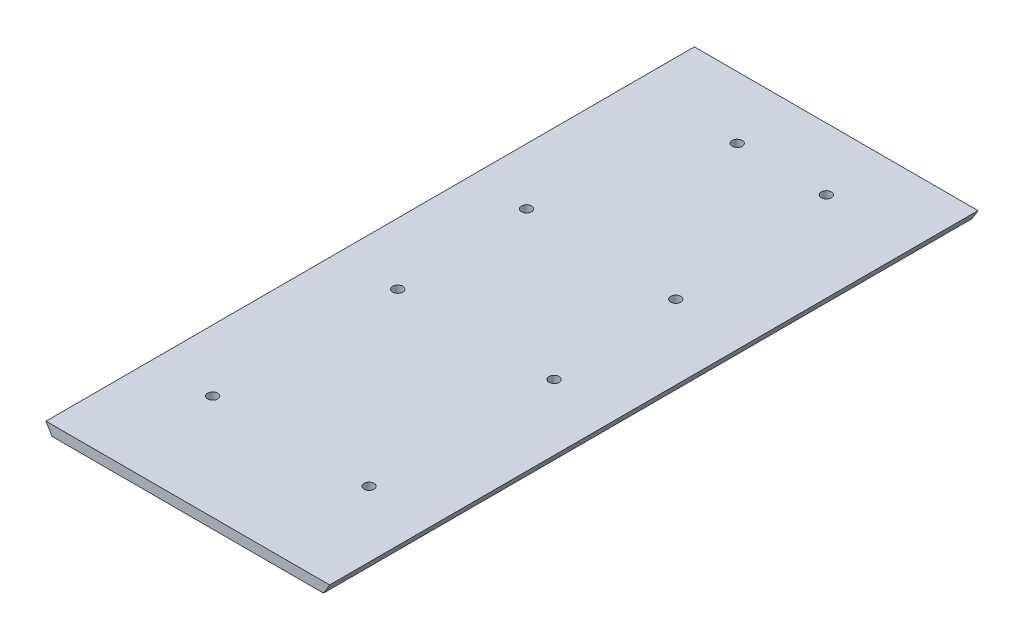
from build123d import *

# Parameters (mm, degrees)
BOSS_EXTRUDE1_DEPTH = 203.2
SKETCH3_R           = 1.5875
CUT_EXTRUDE1_DEPTH  = 209.029529299
SKETCH4_R           = 1.5875
CUT_EXTRUDE2_DEPTH  = 209.029529299


with BuildPart() as part:
    # Sketch2 → Boss-Extrude1 (new body)
    with BuildSketch(Plane.XY):
        with BuildLine():
            Line((-44.45, -24.593444248), (44.45, -24.593444248))
            ThreePointArc((44.45, -24.593444248), (43.515559877, -26.211372506), (42.522255607, -27.793844248))
            Line((42.522255607, -27.793844248), (-42.522255607, -27.793844248))
            ThreePointArc((-42.522255607, -27.793844248), (-43.515559877, -26.211372506), (-44.45, -24.593444248))
        make_face()
    extrude(amount=BOSS_EXTRUDE1_DEPTH)

    # Sketch3 → Cut-Extrude1 (cut, through all)
    with BuildSketch(Plane(origin=(0, -24.593444248, 0), x_dir=(1, 0, 0), z_dir=(0, 1, 0))):
        with Locations(Location((16.401757706, -19.478925293, 0), (0, 0, 270))):
            Circle(SKETCH3_R)
        with Locations(Location((-26.778242294, -70.278925293, 0), (0, 0, 270))):
            Circle(SKETCH3_R)
        with Locations(Location((21.137926992, -71.421925293, 0), (0, 0, 270))):
            Circle(SKETCH3_R)
        with Locations(Location((-11.538242294, -19.478925293, 0), (0, 0, 270))):
            Circle(SKETCH3_R)
    extrude(amount=-CUT_EXTRUDE1_DEPTH, mode=Mode.SUBTRACT)

    # Sketch4 → Cut-Extrude2 (cut, through all)
    with BuildSketch(Plane(origin=(0, -24.593444248, 0), x_dir=(1, 0, 0), z_dir=(0, 1, 0))):
        with Locations(Location((-25.152417206, -170.253365494, 0), (0, 0, 270))):
            Circle(SKETCH4_R)
        with Locations(Location((23.847582794, -170.253365494, 0), (0, 0, 270))):
            Circle(SKETCH4_R)
        with Locations(Location((23.847582794, -112.253365494, 0), (0, 0, 270))):
            Circle(SKETCH4_R)
        with Locations(Location((-25.152417206, -112.253365494, 0), (0, 0, 270))):
            Circle(SKETCH4_R)
    extrude(amount=-CUT_EXTRUDE2_DEPTH, mode=Mode.SUBTRACT)


solid = part.part
